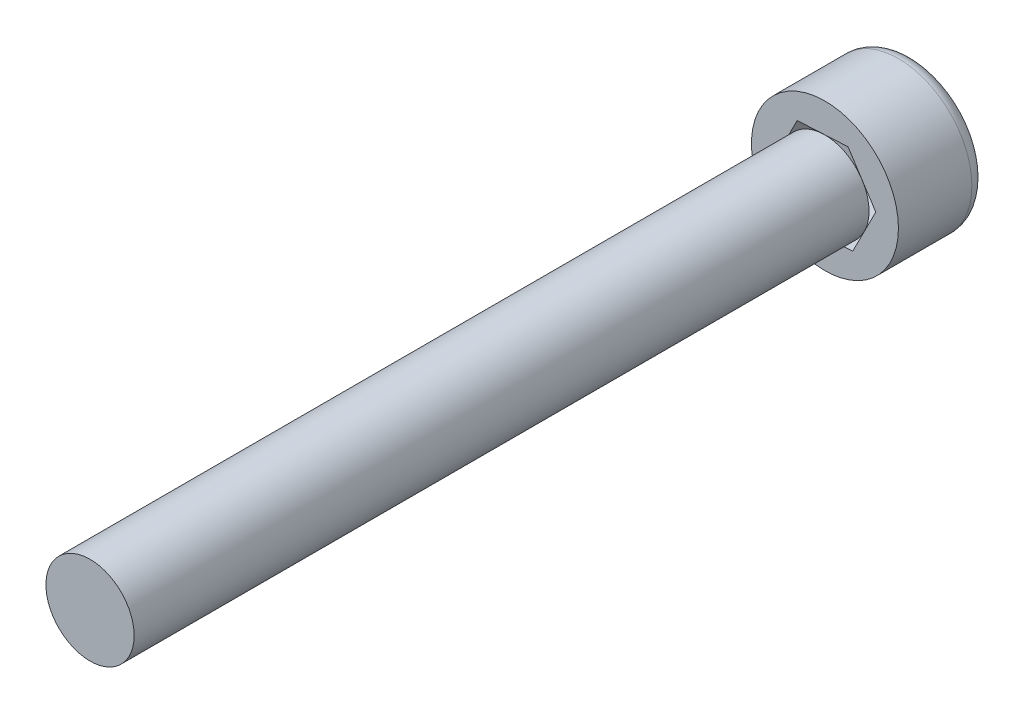
from build123d import *

# Parameters (mm, degrees)
SKETCH1_R           = 2.5
BOSS_EXTRUDE1_DEPTH = 3
SKETCH2_R           = 1.5
BOSS_EXTRUDE2_DEPTH = 25
CUT_EXTRUDE1_DEPTH  = 3
FILLET1_R           = 0.5


with BuildPart() as part:
    # Sketch1 → Boss-Extrude1 (new body)
    with BuildSketch(Plane.XY):
        Circle(SKETCH1_R)
    extrude(amount=BOSS_EXTRUDE1_DEPTH)

    # Sketch2 → Boss-Extrude2 (add)
    with BuildSketch(Plane.XY.offset(3)):
        Circle(SKETCH2_R)
    extrude(amount=BOSS_EXTRUDE2_DEPTH)

    # Sketch3 → Cut-Extrude1 (cut)
    with BuildSketch(Plane(origin=(0, 0, 0), x_dir=(-1, 0, 0), z_dir=(0, 0, -1))):
        Polygon((0.784462107, -1.544221229), (1.729565866, -0.092746502), (0.94510376, 1.451474727), (-0.784462107, 1.544221229), (-1.729565866, 0.092746502), (-0.94510376, -1.451474727), align=None)
    extrude(amount=-CUT_EXTRUDE1_DEPTH, mode=Mode.SUBTRACT)


with BuildPart() as cut_extrude1_piece_1:
    # of the separate pieces the step leaves, piece 1, a body of its own (cut_extrude1_pieces)
    add(part.part.solids().sort_by_distance((1.5, 0, 3))[0])


with BuildPart() as cut_extrude1_piece_2:
    # of the separate pieces the step leaves, piece 2, a body of its own (cut_extrude1_pieces)
    add(part.part.solids().sort_by_distance((2.5, 0, 0))[0])

    # Fillet1
    fillet1_edges = [cut_extrude1_piece_2.edges().sort_by_distance(p)[0] for p in [
        (-2.5, 0, 0),
    ]]
    fillet(fillet1_edges, radius=FILLET1_R)


solid = Compound([cut_extrude1_piece_1.part, cut_extrude1_piece_2.part])
